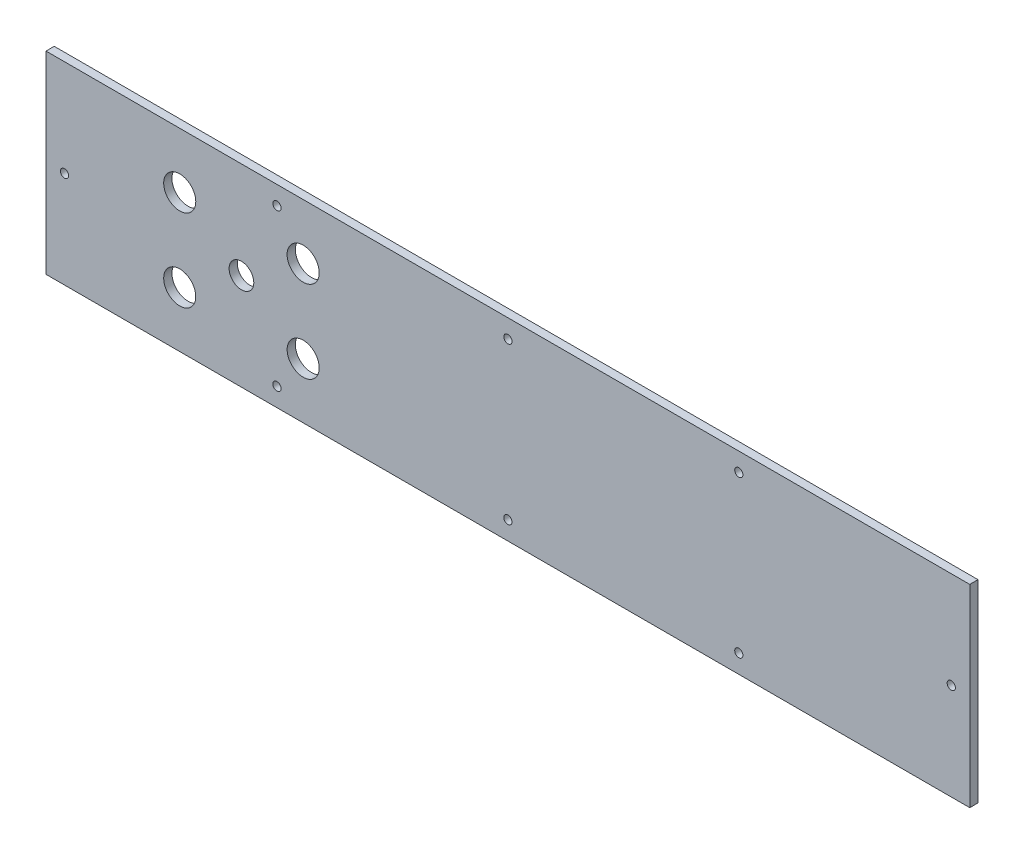
from build123d import *

# Parameters (mm, degrees)
SCHIZZO1_W                   = 449
SCHIZZO1_H                   = 94
SCHIZZO1_R                   = 7.8
SCHIZZO1_R_2                 = 2
SCHIZZO1_R_3                 = 6
ESTRUSIONE_ESTRUSIONE1_DEPTH = 4


with BuildPart() as part:
    # Schizzo1 → Estrusione-Estrusione1 (new body)
    with BuildSketch(Plane.XY):
        with Locations((-224.5, 47)):
            Rectangle(SCHIZZO1_W, SCHIZZO1_H)
        with Locations(Location((-384, 27, 0), (0, 0, 180))):
            Circle(SCHIZZO1_R, mode=Mode.SUBTRACT)
        with Locations((-9, 47)):
            Circle(SCHIZZO1_R_2, mode=Mode.SUBTRACT)
        with Locations((-224.5, 85)):
            Circle(SCHIZZO1_R_2, mode=Mode.SUBTRACT)
        with Locations(Location((-440, 47, 0), (0, 0, 180))):
            Circle(SCHIZZO1_R_2, mode=Mode.SUBTRACT)
        with Locations(Location((-224.5, 9, 0), (0, 0, 180))):
            Circle(SCHIZZO1_R_2, mode=Mode.SUBTRACT)
        with Locations((-324, 27)):
            Circle(SCHIZZO1_R, mode=Mode.SUBTRACT)
        with Locations(Location((-324, 67, 0), (0, 0, 180))):
            Circle(SCHIZZO1_R, mode=Mode.SUBTRACT)
        with Locations((-336.75, 85)):
            Circle(SCHIZZO1_R_2, mode=Mode.SUBTRACT)
        with Locations((-384, 67)):
            Circle(SCHIZZO1_R, mode=Mode.SUBTRACT)
        with Locations(Location((-336.75, 9, 0), (0, 0, 180))):
            Circle(SCHIZZO1_R_2, mode=Mode.SUBTRACT)
        with Locations((-112.25, 9)):
            Circle(SCHIZZO1_R_2, mode=Mode.SUBTRACT)
        with Locations(Location((-112.25, 85, 0), (0, 0, 180))):
            Circle(SCHIZZO1_R_2, mode=Mode.SUBTRACT)
        with Locations((-354, 47)):
            Circle(SCHIZZO1_R_3, mode=Mode.SUBTRACT)
    extrude(amount=ESTRUSIONE_ESTRUSIONE1_DEPTH)


solid = part.part
